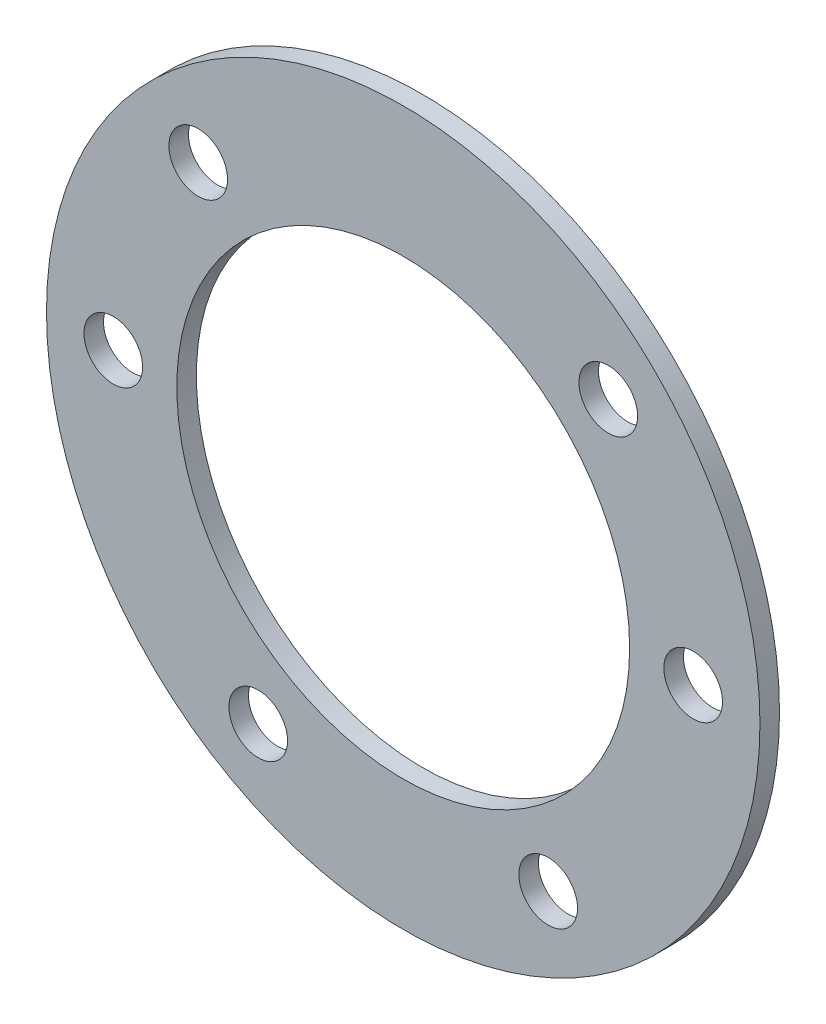
from build123d import *

# Parameters (mm, degrees)
SKETCH_1_R      = 109.5
SKETCH_1_R_2    = 69.5
SKETCH_1_R_3    = 9
EXTRUDE_1_DEPTH = 6


with BuildPart() as part:
    # Эскиз1 → Бобышка-Вытянуть1 (new body)
    with BuildSketch(Plane.XY):
        Circle(SKETCH_1_R)
        Circle(SKETCH_1_R_2, mode=Mode.SUBTRACT)
        with Locations((62.932503526, 62.932503526)):
            Circle(SKETCH_1_R_3, mode=Mode.SUBTRACT)
        with Locations((89, 0)):
            Circle(SKETCH_1_R_3, mode=Mode.SUBTRACT)
        with Locations((-44.5, -77.076260937)):
            Circle(SKETCH_1_R_3, mode=Mode.SUBTRACT)
        with Locations((44.5, -77.076260937)):
            Circle(SKETCH_1_R_3, mode=Mode.SUBTRACT)
        with Locations((-89, 0)):
            Circle(SKETCH_1_R_3, mode=Mode.SUBTRACT)
        with Locations((-62.932503526, 62.932503526)):
            Circle(SKETCH_1_R_3, mode=Mode.SUBTRACT)
    extrude(amount=EXTRUDE_1_DEPTH)


solid = part.part
